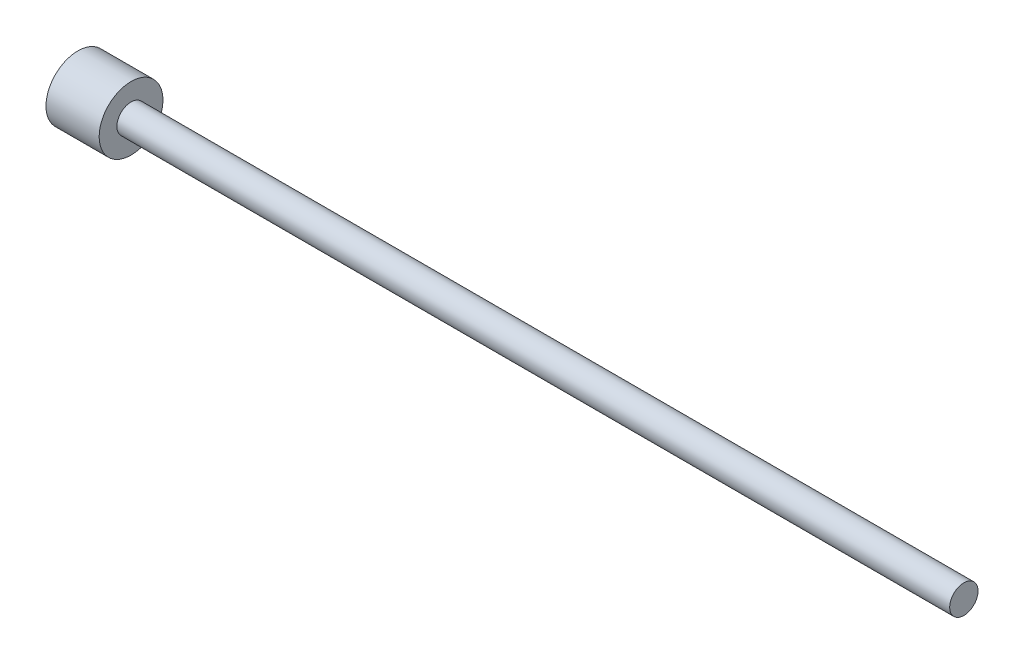
from build123d import *


with BuildPart() as part:
    # 草图1 → 旋转1 (revolve)
    with BuildSketch(Plane.XY, mode=Mode.PRIVATE) as revolve_1_sk:
        Polygon((0, 0), (0, 9), (15, 9), (15, 4), (250, 4), (250, 0), align=None)
    revolve(revolve_1_sk.sketch.rotate(Axis((0, 0, 0), (1, 0, 0)), 90), axis=Axis((0, 0, 0), (1, 0, 0)))


solid = part.part
